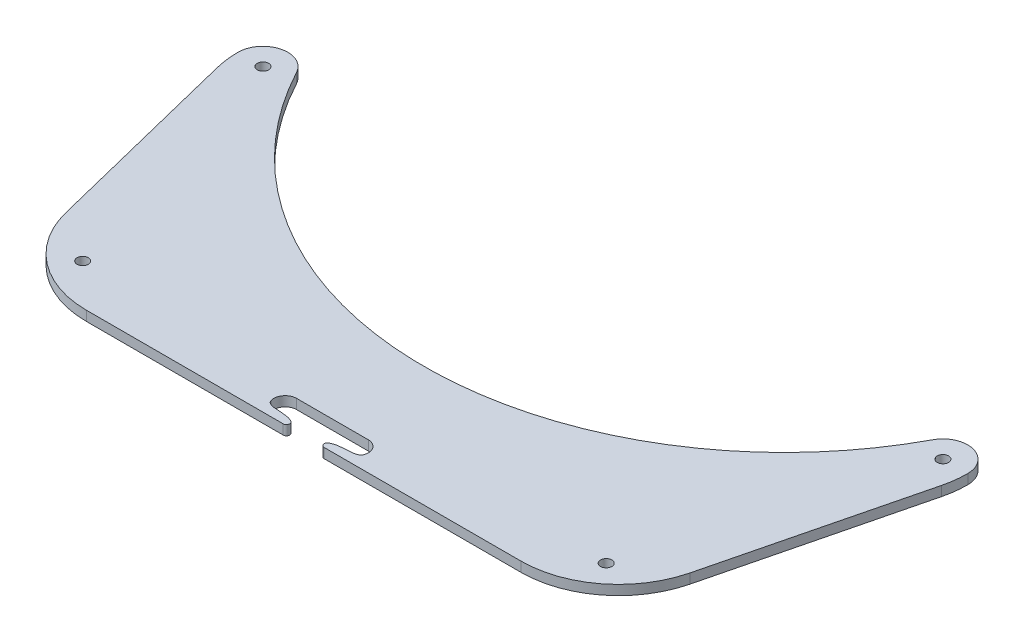
from build123d import *

# Parameters (mm, degrees)
EXTRUDE_1_DEPTH     = 3
CUT_EXTRUDE_START   = -10
CUT_EXTRUDE_1_DEPTH = 10
SKETCH_3_R          = 1.75
CUT_EXTRUDE_2_DEPTH = 10
CUT_EXTRUDE_3_DEPTH = 10


with BuildPart() as part:
    # 草图1 → 凸台-拉伸1 (new body)
    with BuildSketch(Plane(origin=(0, 0, 0), x_dir=(1, 0, 0), z_dir=(0, 1, 0))):
        with BuildLine():
            Line((-66.78059141, 154.593992167), (66.78059141, 154.593992167))
            ThreePointArc((66.78059141, 154.593992167), (85.265515034, 148.222525736), (95.898700635, 131.814498742))
            Line((95.898700635, 131.814498742), (111.265547961, 69.844672358))
            ThreePointArc((111.265547961, 69.844672358), (112.147438737, 62.624165782), (111.265547961, 55.403659207))
            Line((111.265547961, 55.403659207), (95.898700635, -6.566167178))
            ThreePointArc((95.898700635, -6.566167178), (85.265515034, -22.974194171), (66.78059141, -29.345660602))
            Line((66.78059141, -29.345660602), (-66.78059141, -29.345660602))
            ThreePointArc((-66.78059141, -29.345660602), (-85.265515034, -22.974194171), (-95.898700635, -6.566167178))
            Line((-95.898700635, -6.566167178), (-111.265547961, 55.403659207))
            ThreePointArc((-111.265547961, 55.403659207), (-112.147438737, 62.624165782), (-111.265547961, 69.844672358))
            Line((-111.265547961, 69.844672358), (-95.898700635, 131.814498742))
            ThreePointArc((-95.898700635, 131.814498742), (-85.265515034, 148.222525736), (-66.78059141, 154.593992167))
        make_face()
    extrude(amount=EXTRUDE_1_DEPTH)

    # 草图2 → 切除-拉伸1 (cut)
    with BuildSketch(Plane(origin=(0, 3, 0), x_dir=(1, 0, 0), z_dir=(0, 1, 0)).offset(CUT_EXTRUDE_START)):
        with BuildLine():
            Line((111.265547961, 69.844672358), (95.898700635, 131.814498742))
            ThreePointArc((95.898700635, 131.814498742), (85.265515034, 148.222525736), (66.78059141, 154.593992167))
            Line((66.78059141, 154.593992167), (-66.78059141, 154.593992167))
            ThreePointArc((-66.78059141, 154.593992167), (-85.265515034, 148.222525736), (-95.898700635, 131.814498742))
            Line((-95.898700635, 131.814498742), (-111.265547961, 69.844672358))
            ThreePointArc((-111.265547961, 69.844672358), (-111.926149897, 66.261247255), (-112.147438737, 62.624165782))
            ThreePointArc((-112.147438737, 62.624165782), (-106.361047775, 70.035823246), (-97.766986015, 66.220447882))
            ThreePointArc((-97.766986015, 66.220447882), (0, 7.570427798), (97.766986015, 66.220447882))
            ThreePointArc((97.766986015, 66.220447882), (106.361047775, 70.035823246), (112.147438737, 62.624165782))
            ThreePointArc((112.147438737, 62.624165782), (111.926149897, 66.261247255), (111.265547961, 69.844672358))
        make_face()
    extrude(amount=CUT_EXTRUDE_1_DEPTH, mode=Mode.SUBTRACT)

    # 草图3 → 切除-拉伸2 (cut)
    with BuildSketch(Plane(origin=(0, 3, 0), x_dir=(1, 0, 0), z_dir=(0, 1, 0))):
        with Locations(Location((-80.450184708, -16.818951307, 0), (0, 0, 270))):
            Circle(SKETCH_3_R)
        with Locations(Location((-104.507530951, 62.624165782, 0), (0, 0, 270))):
            Circle(SKETCH_3_R)
        with Locations(Location((104.507530951, 62.624165782, 0), (0, 0, 270))):
            Circle(SKETCH_3_R)
        with Locations(Location((80.450184708, -16.818951307, 0), (0, 0, 270))):
            Circle(SKETCH_3_R)
    extrude(amount=-CUT_EXTRUDE_2_DEPTH, mode=Mode.SUBTRACT)

    # 草图4 → 切除-拉伸3 (cut)
    with BuildSketch(Plane(origin=(0, 3, 0), x_dir=(1, 0, 0), z_dir=(0, 1, 0))):
        with BuildLine():
            Line((11.016648097, -20.513898252), (-11.016648097, -20.513898252))
            ThreePointArc((-11.016648097, -20.513898252), (-13.814702514, -21.911306641), (-14.378457093, -24.987674549))
            add(Edge.make_bspline(
                [(-14.378457093, -24.987674549), (-14.050661547, -26.11933694), (-10.489346867, -26.76009099), (-7.724749574, -26.493757466), (-5.904508816, -27.417302496), (-5.804576355, -27.473305111)],
                knots=[0, 0, 0, 0, 0.274123853, 0.745489655, 0.777393608, 0.777393608, 0.777393608, 0.777393608], degree=3))
            ThreePointArc((-5.804576355, -27.473305111), (-5.325885634, -28.59829127), (-6.293448421, -29.345660602))
            Line((-6.293448421, -29.345660602), (6.293448421, -29.345660602))
            ThreePointArc((6.293448421, -29.345660602), (5.325885634, -28.59829127), (5.804576355, -27.473305111))
            add(Edge.make_bspline(
                [(5.804576355, -27.473305111), (5.904508816, -27.417302496), (7.724749574, -26.493757466), (10.489346867, -26.76009099), (14.050661547, -26.11933694), (14.378457093, -24.987674549)],
                knots=[0, 0, 0, 0, 0.031903952, 0.503269754, 0.777393608, 0.777393608, 0.777393608, 0.777393608], degree=3))
            ThreePointArc((14.378457093, -24.987674549), (13.814702514, -21.911306641), (11.016648097, -20.513898252))
        make_face()
    extrude(amount=-CUT_EXTRUDE_3_DEPTH, mode=Mode.SUBTRACT)


solid = part.part
